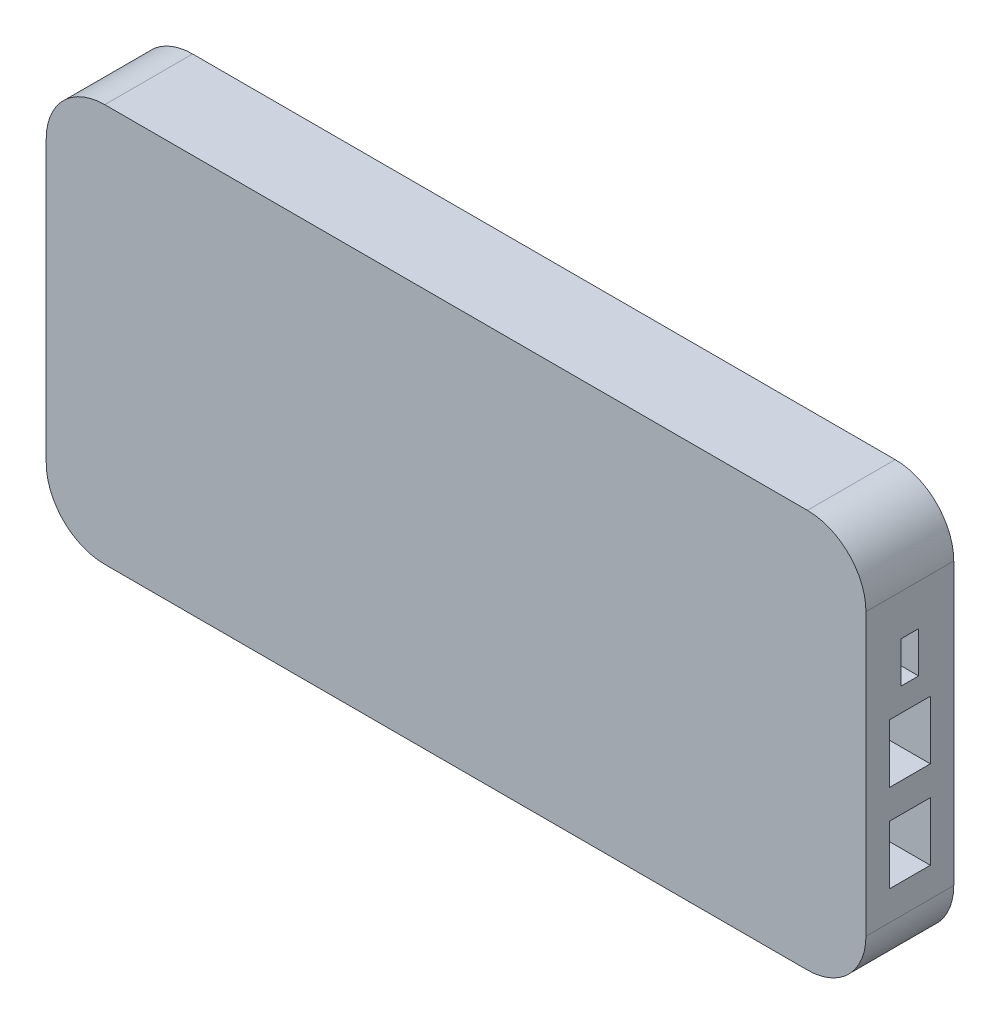
from build123d import *

# Parameters (mm, degrees)
Y_KSEKLIK_EKSTR_ZYON1_DEPTH = 15
IZIM2_W                     = 7
IZIM2_H                     = 10
IZIM2_W_2                   = 3
IZIM2_H_2                   = 7
KES_EKSTR_ZYON1_DEPTH       = 10


with BuildPart() as part:
    # Çizim1 → Yükseklik-Ekstrüzyon1 (new body)
    with BuildSketch(Plane.XY):
        with BuildLine():
            Line((10, 0), (130, 0))
            ThreePointArc((130, 0), (137.071067812, 2.928932188), (140, 10))
            Line((140, 10), (140, 58))
            ThreePointArc((140, 58), (137.071067812, 65.071067812), (130, 68))
            Line((130, 68), (10, 68))
            ThreePointArc((10, 68), (2.928932188, 65.071067812), (0, 58))
            Line((0, 58), (0, 10))
            ThreePointArc((0, 10), (2.928932188, 2.928932188), (10, 0))
        make_face()
    extrude(amount=Y_KSEKLIK_EKSTR_ZYON1_DEPTH)

    # Çizim2 → Kes-Ekstrüzyon1 (cut)
    with BuildSketch(Plane(origin=(140, 0, 0), x_dir=(0, 0, -1), z_dir=(1, 0, 0))):
        with Locations((-7.5, 20)):
            Rectangle(IZIM2_W, IZIM2_H)
        with Locations((-7.5, 35)):
            Rectangle(IZIM2_W, IZIM2_H)
        with Locations((-7.5, 47.5)):
            Rectangle(IZIM2_W_2, IZIM2_H_2)
    extrude(amount=-KES_EKSTR_ZYON1_DEPTH, mode=Mode.SUBTRACT)


solid = part.part
